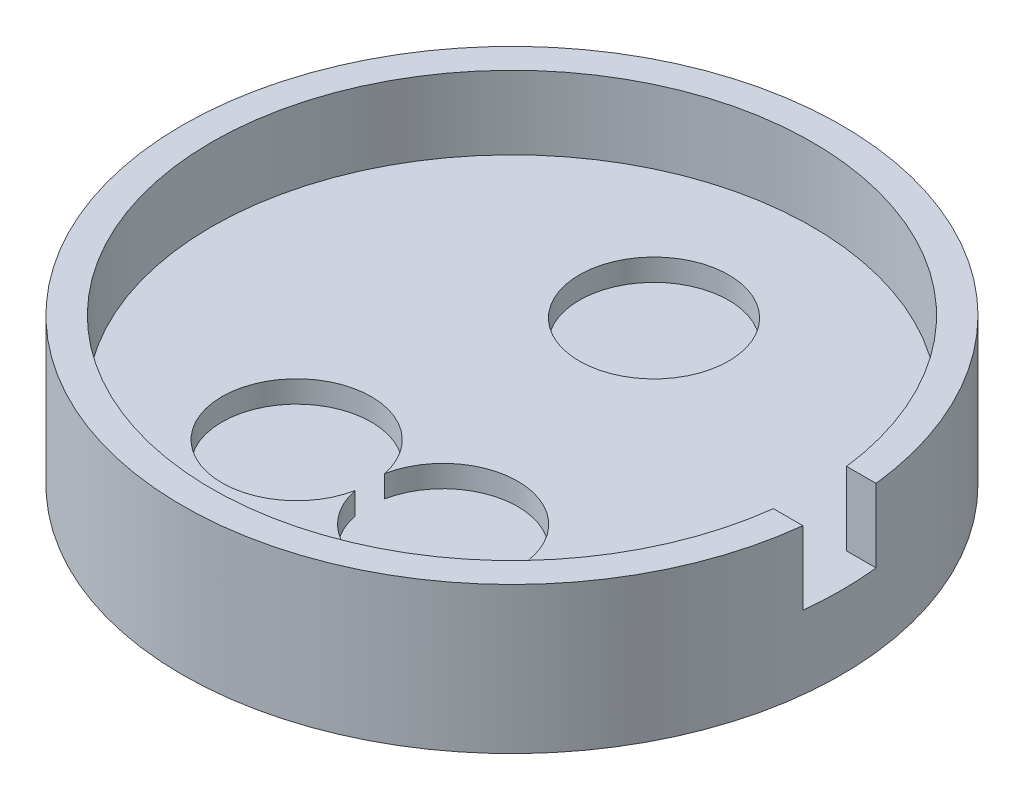
from build123d import *

# Parameters (mm, degrees)
SKETCH_1_R          = 22.5
SKETCH_1_R_2        = 20.5
EXTRUDE_1_DEPTH     = 5
EXTRUDE_START       = -5
SKETCH_1_4_R        = 22.5
EXTRUDE_2_DEPTH     = 5
SKETCH_2_R          = 5.1
CUT_EXTRUDE_1_DEPTH = 1.5
SKETCH_3_W          = 30
SKETCH_3_H          = 5
CUT_EXTRUDE_2_DEPTH = 5
SKETCH_4_R          = 0.6
CUT_EXTRUDE_3_DEPTH = 3


with BuildPart() as part:
    # 草图1 → 凸台-拉伸1 (new body)
    with BuildSketch(Plane(origin=(0, 0, 0), x_dir=(1, 0, 0), z_dir=(0, 1, 0))):
        with Locations(Location((0, 0, 0), (0, 0, 270))):
            Circle(SKETCH_1_R)
        with Locations(Location((0, 0, 0), (0, 0, 270))):
            Circle(SKETCH_1_R_2, mode=Mode.SUBTRACT)
    extrude(amount=EXTRUDE_1_DEPTH)

    # 草图1<4> → 凸台-拉伸2 (add)
    with BuildSketch(Plane(origin=(0, 0, 0), x_dir=(1, 0, 0), z_dir=(0, 1, 0)).offset(EXTRUDE_START)):
        with Locations(Location((0, 0, 0), (0, 0, 270))):
            Circle(SKETCH_1_4_R)
    extrude(amount=EXTRUDE_2_DEPTH)

    # 草图2 → 切除-拉伸1 (cut)
    with BuildSketch(Plane(origin=(0, 0, 0), x_dir=(1, 0, 0), z_dir=(0, 1, 0))):
        with Locations(Location((0, 9.7, 0), (0, 0, 270))):
            Circle(SKETCH_2_R)
        with Locations((-5, -9.7)):
            Circle(SKETCH_2_R)
        with Locations((5, -9.7)):
            Circle(SKETCH_2_R)
    extrude(amount=-CUT_EXTRUDE_1_DEPTH, mode=Mode.SUBTRACT)

    # 草图3 → 切除-拉伸2 (cut)
    with BuildSketch(Plane(origin=(0, 5, 0), x_dir=(1, 0, 0), z_dir=(0, 1, 0))):
        with Locations((15, 0)):
            Rectangle(SKETCH_3_W, SKETCH_3_H)
    extrude(amount=-CUT_EXTRUDE_2_DEPTH, mode=Mode.SUBTRACT)

    # 草图4 → 切除-拉伸3 (cut)
    with BuildSketch(Plane.XZ.offset(5)):
        with Locations(Location((-10, 0, 0), (0, 0, 270))):
            Circle(SKETCH_4_R)
        with Locations(Location((10, 0, 0), (0, 0, 270))):
            Circle(SKETCH_4_R)
    extrude(amount=-CUT_EXTRUDE_3_DEPTH, mode=Mode.SUBTRACT)


solid = part.part
